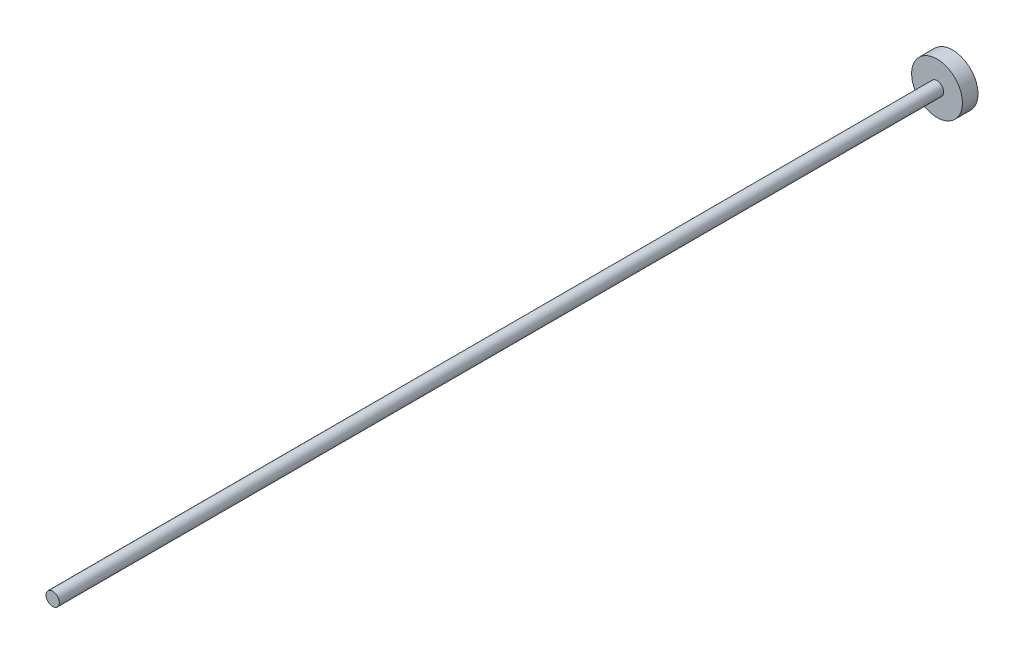
from build123d import *

# Parameters (mm, degrees)
SKETCH1_R           = 2.44
BOSS_EXTRUDE1_DEPTH = 1.5
SKETCH2_R           = 0.64
BOSS_EXTRUDE2_DEPTH = 85


with BuildPart() as part:
    # Sketch1 → Boss-Extrude1 (new body)
    with BuildSketch(Plane.XY):
        Circle(SKETCH1_R)
    extrude(amount=BOSS_EXTRUDE1_DEPTH)

    # Sketch2 → Boss-Extrude2 (add)
    with BuildSketch(Plane.XY.offset(1.5)):
        Circle(SKETCH2_R)
    extrude(amount=BOSS_EXTRUDE2_DEPTH)


solid = part.part
